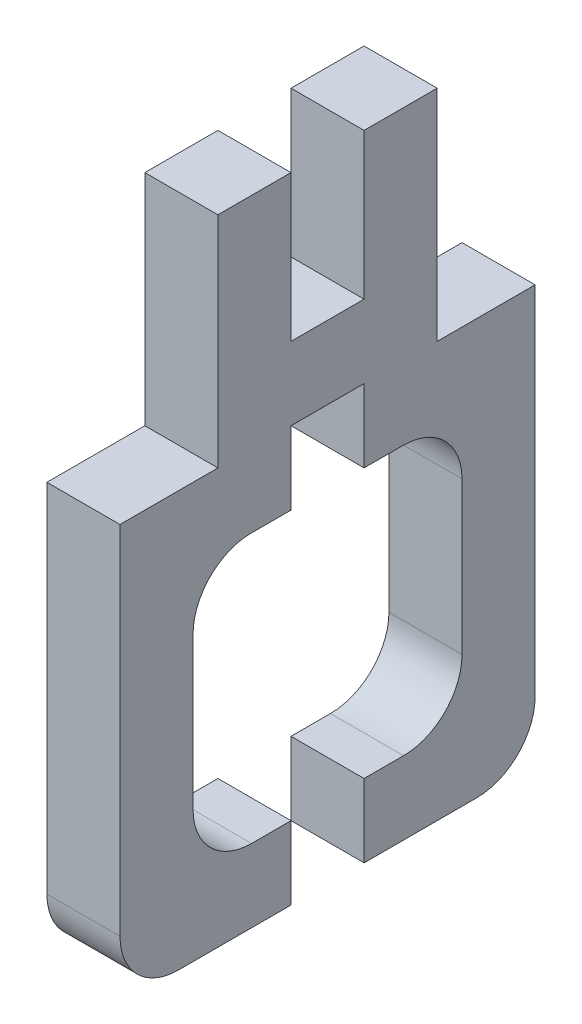
from build123d import *

# Parameters (mm, degrees)
BOSS_EXTRUDE1_DEPTH = 6.35


with BuildPart() as part:
    # Sketch2 → Boss-Extrude1 (new body)
    with BuildSketch(Plane(origin=(0, 0, 0), x_dir=(0, 0, -1), z_dir=(1, 0, 0))):
        with BuildLine():
            Line((14.859, 42.418), (14.859, 55.118))
            Line((14.859, 55.118), (8.509, 55.118))
            Line((8.509, 55.118), (8.509, 36.068))
            Line((8.509, 36.068), (0, 36.068))
            Line((0, 36.068), (0, 5.08))
            ThreePointArc((0, 5.08), (1.487897552, 1.487897552), (5.08, 0))
            Line((5.08, 0), (14.859, 0))
            Line((14.859, 0), (14.859, 6.35))
            Line((14.859, 6.35), (11.43, 6.35))
            ThreePointArc((11.43, 6.35), (7.837897552, 7.837897552), (6.35, 11.43))
            Line((6.35, 11.43), (6.35, 24.638))
            ThreePointArc((6.35, 24.638), (7.837897552, 28.230102448), (11.43, 29.718))
            Line((11.43, 29.718), (14.859, 29.718))
            Line((14.859, 29.718), (14.859, 36.068))
            Line((14.859, 36.068), (21.209, 36.068))
            Line((21.209, 36.068), (21.209, 29.718))
            Line((21.209, 29.718), (24.638, 29.718))
            ThreePointArc((24.638, 29.718), (28.230102448, 28.230102448), (29.718, 24.638))
            Line((29.718, 24.638), (29.718, 11.43))
            ThreePointArc((29.718, 11.43), (28.230102448, 7.837897552), (24.638, 6.35))
            Line((24.638, 6.35), (21.209, 6.35))
            Line((21.209, 6.35), (21.209, 0))
            Line((21.209, 0), (30.988, 0))
            ThreePointArc((30.988, 0), (34.580102448, 1.487897552), (36.068, 5.08))
            Line((36.068, 5.08), (36.068, 36.068))
            Line((36.068, 36.068), (27.559, 36.068))
            Line((27.559, 36.068), (27.559, 55.118))
            Line((27.559, 55.118), (21.209, 55.118))
            Line((21.209, 55.118), (21.209, 42.418))
            Line((21.209, 42.418), (14.859, 42.418))
        make_face()
    extrude(amount=BOSS_EXTRUDE1_DEPTH)


solid = part.part
